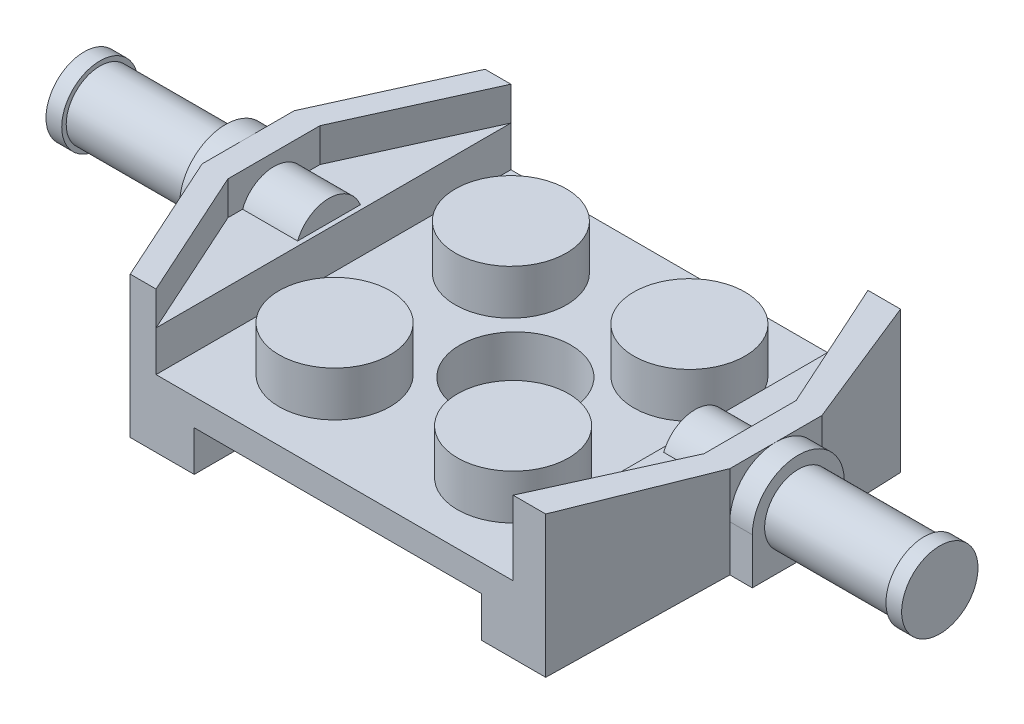
from build123d import *

# Parameters (mm, degrees)
SKETCH1_W                = 23.5
SKETCH1_H                = 15.8
BOSS_EXTRUDE1_DEPTH      = 6.3
SKETCH3_W                = 15.9
SKETCH3_H                = 15.8
CUT_EXTRUDE1_DEPTH       = 3.3
CUT_EXTRUDE2_DEPTH       = 30.009998276
CUT_EXTRUDE3_DEPTH       = 1.5
CUT_EXTRUDE4_DEPTH       = 30.009998276
BOSS_EXTRUDE2_DEPTH      = 1
BOSS_EXTRUDE3_DEPTH      = 5.6
BOSS_EXTRUDE3_DEPTH_BACK = 4.6
SKETCH9_R                = 1.5
BOSS_EXTRUDE4_START      = 1
BOSS_EXTRUDE4_DEPTH      = 1
BOSS_EXTRUDE5_DEPTH      = 5.6
BOSS_EXTRUDE5_DEPTH_BACK = 4.6
SKETCH11_R               = 1.5
CUT_EXTRUDE5_DEPTH       = 1.8
SKETCH13_R               = 2.475
CUT_EXTRUDE6_DEPTH       = 35.573689418
CUT_EXTRUDE7_DEPTH       = 2.8
SKETCH15_R               = 1.7
BOSS_EXTRUDE7_DEPTH      = 0.7
BOSS_EXTRUDE8_START      = 0.7
SKETCH16_R               = 1.7
BOSS_EXTRUDE8_DEPTH      = 0.7
SKETCH17_R               = 2.475
BOSS_EXTRUDE9_DEPTH      = 2


with BuildPart() as part:
    # Sketch1 → Boss-Extrude1 (new body)
    with BuildSketch(Plane(origin=(0, 0, 0), x_dir=(1, 0, 0), z_dir=(0, 1, 0))):
        with Locations((11.75, -7.9)):
            Rectangle(SKETCH1_W, SKETCH1_H)
    extrude(amount=BOSS_EXTRUDE1_DEPTH)

    # Sketch3 → Cut-Extrude1 (cut)
    with BuildSketch(Plane(origin=(0, 6.3, 0), x_dir=(1, 0, 0), z_dir=(0, 1, 0))):
        with Locations((11.75, -7.9)):
            Rectangle(SKETCH3_W, SKETCH3_H)
    extrude(amount=-CUT_EXTRUDE1_DEPTH, mode=Mode.SUBTRACT)

    # Sketch4 → Cut-Extrude2 (cut, through all)
    with BuildSketch(Plane(origin=(0, 6.3, 0), x_dir=(1, 0, 0), z_dir=(0, 1, 0))):
        Polygon((21.15, 0), (23.5, -5.85), (23.5, 0), align=None)
        Polygon((21.15, -15.8), (23.5, -9.95), (23.5, -15.8), align=None)
        Polygon((2.65, -15.8), (0, -9.95), (0, -15.8), align=None)
        Polygon((0, 0), (0, -5.85), (2.65, 0), align=None)
    extrude(amount=-CUT_EXTRUDE2_DEPTH, mode=Mode.SUBTRACT)

    # Sketch5 → Cut-Extrude3 (cut)
    with BuildSketch(Plane(origin=(0, 6.3, 0), x_dir=(1, 0, 0), z_dir=(0, 1, 0))):
        Polygon((3.8, 0), (1.15, -5.85), (1.15, -9.95), (3.8, -15.8), align=None)
        Polygon((19.7, 0), (19.7, -15.8), (22.35, -9.95), (22.35, -5.85), align=None)
    extrude(amount=-CUT_EXTRUDE3_DEPTH, mode=Mode.SUBTRACT)

    # Sketch7 → Cut-Extrude4 (cut, through all)
    with BuildSketch(Plane.XY.offset(15.8)):
        Polygon((0, 0), (0, 2.2), (2.65, 0), align=None)
        Polygon((21.15, 0), (23.5, 0), (23.5, 2.2), align=None)
    extrude(amount=-CUT_EXTRUDE4_DEPTH, mode=Mode.SUBTRACT)

    # Sketch8 → Boss-Extrude2 (add)
    with BuildSketch(Plane(origin=(23.5, 0, 0), x_dir=(0, 0, -1), z_dir=(1, 0, 0))):
        with BuildLine():
            Line((-9.95, 4.25), (-9.95, 2.2))
            Line((-9.95, 2.2), (-5.85, 2.2))
            Line((-5.85, 2.2), (-5.85, 4.25))
            ThreePointArc((-5.85, 4.25), (-7.9, 6.3), (-9.95, 4.25))
        make_face()
    extrude(amount=BOSS_EXTRUDE2_DEPTH)

    # Sketch9 → Boss-Extrude3 (add, two sides: drawn at the far end of the back side and taken through both)
    with BuildSketch(Plane(origin=(24.5, 0, 0), x_dir=(0, 0, -1), z_dir=(1, 0, 0)).offset(-BOSS_EXTRUDE3_DEPTH_BACK)):
        with Locations((-7.9, 4.25)):
            Circle(SKETCH9_R)
    extrude(amount=BOSS_EXTRUDE3_DEPTH + BOSS_EXTRUDE3_DEPTH_BACK)

    # Sketch10 → Boss-Extrude4 (add)
    with BuildSketch(Plane.ZY.offset(BOSS_EXTRUDE4_START)):
        with BuildLine():
            Line((5.85, 2.2), (9.95, 2.2))
            Line((9.95, 2.2), (9.95, 4.25))
            ThreePointArc((9.95, 4.25), (7.9, 6.3), (5.85, 4.25))
            Line((5.85, 4.25), (5.85, 2.2))
        make_face()
    extrude(amount=-BOSS_EXTRUDE4_DEPTH)

    # Sketch11 → Boss-Extrude5 (add, two sides: drawn at the far end of the back side and taken through both)
    with BuildSketch(Plane.ZY.offset(1).offset(-BOSS_EXTRUDE5_DEPTH_BACK)):
        with Locations(Location((7.9, 4.25, 0), (0, 0, 180))):
            Circle(SKETCH11_R)
    extrude(amount=BOSS_EXTRUDE5_DEPTH + BOSS_EXTRUDE5_DEPTH_BACK)

    # Sketch12 → Cut-Extrude5 (cut)
    with BuildSketch(Plane.XZ):
        with BuildLine():
            Line((18.3, 15.8), (5.5, 15.8))
            Line((5.5, 15.8), (5.5, 8.5))
            Line((5.5, 8.5), (8.756753271, 8.5))
            ThreePointArc((8.756753271, 8.5), (11.885259229, 11.099966048), (15.037585601, 8.528932905))
            Line((15.037585601, 8.528932905), (18.3, 8.5))
            Line((18.3, 8.5), (18.3, 15.8))
        make_face()
        with BuildLine():
            Line((8.756753271, 7.3), (5.5, 7.3))
            Line((5.5, 7.3), (5.5, 0))
            Line((5.5, 0), (18.3, 0))
            Line((18.3, 0), (18.3, 7.3))
            Line((18.3, 7.3), (15.043246729, 7.3))
            ThreePointArc((15.043246729, 7.3), (11.9, 4.7), (8.756753271, 7.3))
        make_face()
    extrude(amount=-CUT_EXTRUDE5_DEPTH, mode=Mode.SUBTRACT)

    # Sketch13 → Cut-Extrude6 (cut, through all)
    with BuildSketch(Plane.XZ):
        with Locations(Location((11.9, 7.9, 0), (0, 0, 270))):
            Circle(SKETCH13_R)
    extrude(amount=-CUT_EXTRUDE6_DEPTH, mode=Mode.SUBTRACT)

    # Sketch14 → Cut-Extrude7 (cut)
    with BuildSketch(Plane.XZ):
        with BuildLine():
            Line((4, 13.567291996), (4, 2.232708004))
            ThreePointArc((4, 2.232708004), (3.880084058, 2.085755802), (3.712067341, 2.173762423))
            Line((3.712067341, 2.173762423), (1.5, 7.35))
            Line((1.5, 7.35), (1.5, 8.45))
            Line((1.5, 8.45), (3.712067341, 13.626237577))
            ThreePointArc((3.712067341, 13.626237577), (3.880084058, 13.714244198), (4, 13.567291996))
        make_face()
        with BuildLine():
            Line((20.087932659, 2.173762423), (22.3, 7.35))
            Line((22.3, 7.35), (22.3, 8.45))
            Line((22.3, 8.45), (20.087932659, 13.626237577))
            ThreePointArc((20.087932659, 13.626237577), (19.919915942, 13.714244198), (19.8, 13.567291996))
            Line((19.8, 13.567291996), (19.8, 2.232708004))
            ThreePointArc((19.8, 2.232708004), (19.919915942, 2.085755802), (20.087932659, 2.173762423))
        make_face()
    extrude(amount=-CUT_EXTRUDE7_DEPTH, mode=Mode.SUBTRACT)

    # Sketch15 → Boss-Extrude7 (add)
    with BuildSketch(Plane.ZY.offset(6.6)):
        with Locations((7.9, 4.25)):
            Circle(SKETCH15_R)
    extrude(amount=BOSS_EXTRUDE7_DEPTH)

    # Sketch16 → Boss-Extrude8 (add)
    with BuildSketch(Plane(origin=(30.1, 0, 0), x_dir=(0, 0, -1), z_dir=(1, 0, 0)).offset(BOSS_EXTRUDE8_START)):
        with Locations(Location((-7.9, 4.25, 0), (0, 0, 180))):
            Circle(SKETCH16_R)
    extrude(amount=-BOSS_EXTRUDE8_DEPTH)

    # Sketch17 → Boss-Extrude9 (add)
    with BuildSketch(Plane(origin=(0, 3, 0), x_dir=(1, 0, 0), z_dir=(0, 1, 0))):
        with Locations(Location((7.775, -3.975, 0), (0, 0, 270))):
            Circle(SKETCH17_R)
        with Locations(Location((7.775, -11.825, 0), (0, 0, 270))):
            Circle(SKETCH17_R)
        with Locations(Location((15.725, -11.825, 0), (0, 0, 270))):
            Circle(SKETCH17_R)
        with Locations(Location((15.725, -3.975, 0), (0, 0, 270))):
            Circle(SKETCH17_R)
    extrude(amount=BOSS_EXTRUDE9_DEPTH)


solid = part.part
